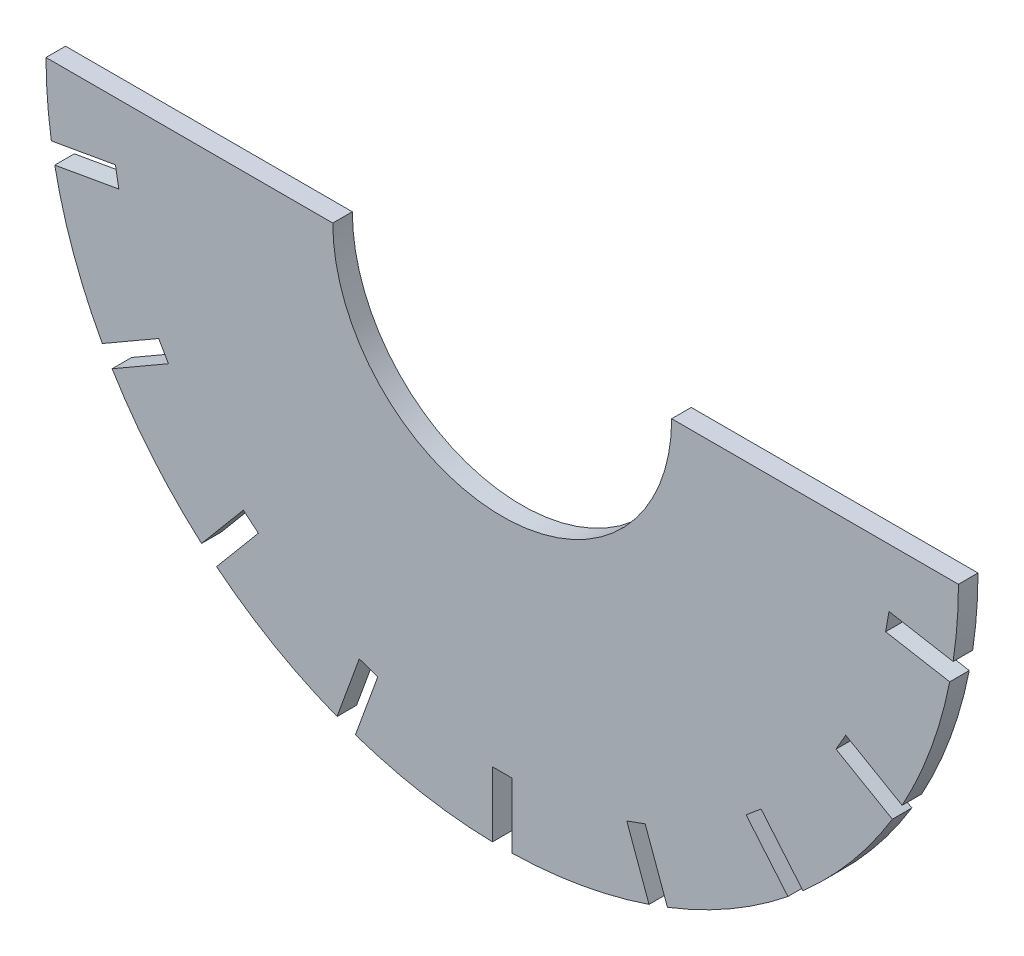
from build123d import *

# Parameters (mm, degrees)
BOSS_EXTRUDE1_DEPTH             = 3
SKETCH5_W                       = 3
SKETCH5_H                       = 10
CUT_EXTRUDE2_DEPTH              = 100.040395799
CIRPATTERN1_COUNT               = 5
CIRPATTERN1_ANGLE               = 80
CIRPATTERN1_THE_OTHER_WAY_COUNT = 5
CIRPATTERN1_THE_OTHER_WAY_ANGLE = 80
SKETCH6_R                       = 26
CUT_EXTRUDE3_DEPTH              = 100.029036146


with BuildPart() as part:
    # Sketch4 → Boss-Extrude1 (new body)
    with BuildSketch(Plane.XY):
        with BuildLine():
            Line((70, 0), (-70, 0))
            ThreePointArc((-70, 0), (0, -70), (70, 0))
        make_face()
    extrude(amount=BOSS_EXTRUDE1_DEPTH)

    # Sketch5 → Cut-Extrude2 (cut, through all)
    with BuildSketch(Plane.XY):
        with Locations((0, -65)):
            Rectangle(SKETCH5_W, SKETCH5_H)
    cut_extrude2 = extrude(amount=CUT_EXTRUDE2_DEPTH, mode=Mode.SUBTRACT)

    # CirPattern1: Cut-Extrude2 ×5 about axis
    cirpattern1_axis = Axis((0, 0, 3), (0, 0, -1))
    for i in range(1, CIRPATTERN1_COUNT):
        add(cut_extrude2.rotate(cirpattern1_axis, i * CIRPATTERN1_ANGLE / (CIRPATTERN1_COUNT - 1)), mode=Mode.SUBTRACT)

    # CirPattern1 the other way: Cut-Extrude2 ×5 about axis
    cirpattern1_the_other_way_axis = Axis((0, 0, 3), (0, 0, 1))
    for i in range(1, CIRPATTERN1_THE_OTHER_WAY_COUNT):
        add(cut_extrude2.rotate(cirpattern1_the_other_way_axis, i * CIRPATTERN1_THE_OTHER_WAY_ANGLE / (CIRPATTERN1_THE_OTHER_WAY_COUNT - 1)), mode=Mode.SUBTRACT)

    # Sketch6 → Cut-Extrude3 (cut, through all)
    with BuildSketch(Plane.XY):
        Circle(SKETCH6_R)
    extrude(amount=CUT_EXTRUDE3_DEPTH, mode=Mode.SUBTRACT)


solid = part.part
